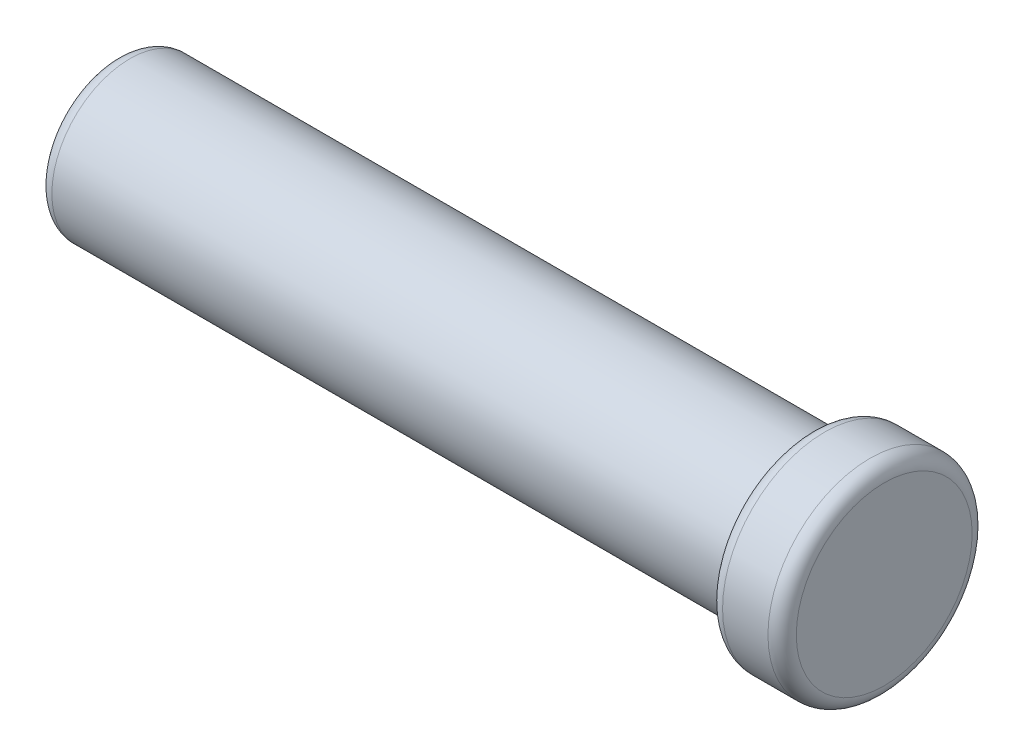
from build123d import *

# Parameters (mm, degrees)
FILLET1_R = 0.5
FILLET2_R = 0.5
FILLET3_R = 0.5


with BuildPart() as part:
    # Sketch1 → Revolve1 (revolve)
    with BuildSketch(Plane(origin=(0, 0, 0), x_dir=(1, 0, 0), z_dir=(0, 1, 0)), mode=Mode.PRIVATE) as revolve1_sk:
        Polygon((0, 0), (27.1, 0), (27.1, 3.6), (24.5, 3.6), (24.5, 2.75), (0, 2.75), align=None)
    revolve(revolve1_sk.sketch.rotate(Axis((0, 0, 0), (1, 0, 0)), 180), axis=Axis((0, 0, 0), (1, 0, 0)))

    # Fillet1
    fillet1_edges = [part.edges().sort_by_distance(p)[0] for p in [
        (27.1, 0, -3.6),
    ]]
    fillet(fillet1_edges, radius=FILLET1_R)

    # Fillet2
    fillet2_edges = [part.edges().sort_by_distance(p)[0] for p in [
        (0, 0, -2.75),
    ]]
    fillet(fillet2_edges, radius=FILLET2_R)

    # Fillet3
    fillet3_edges = [part.edges().sort_by_distance(p)[0] for p in [
        (24.5, 0, -3.6),
    ]]
    fillet(fillet3_edges, radius=FILLET3_R)


solid = part.part
